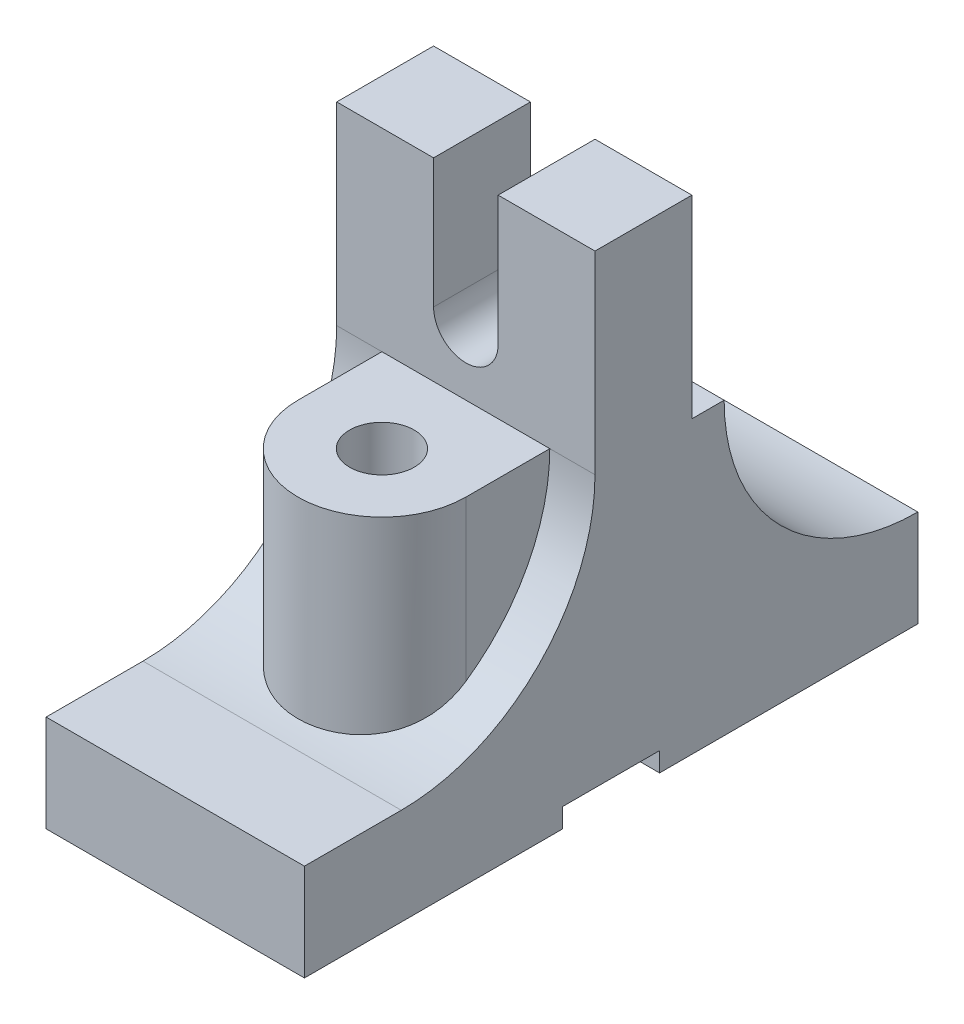
from build123d import *

# Parameters (mm, degrees)
BOSS_EXTRUDE4_DEPTH      = 20
BOSS_EXTRUDE5_REACH      = 70.42
BOSS_EXTRUDE5_END_RADIUS = 30
SKETCH7_R                = 5
CUT_EXTRUDE1_DEPTH       = 69.419660946
SKETCH8_W                = 15
SKETCH8_H                = 30
BOSS_EXTRUDE6_DEPTH      = 40
CUT_EXTRUDE2_REACH       = 94.331


with BuildPart() as part:
    # Sketch1 → Boss-Extrude4 (new, symmetric)
    with BuildSketch(Plane(origin=(0, 0, 0), x_dir=(0, 0, -1), z_dir=(1, 0, 0))):
        with BuildLine():
            Line((-47.5, 0), (-7.5, 0))
            Line((-7.5, 0), (-7.5, 3))
            Line((-7.5, 3), (7.5, 3))
            Line((7.5, 3), (7.5, 0))
            Line((7.5, 0), (47.5, 0))
            Line((47.5, 0), (47.5, 15))
            ThreePointArc((47.5, 15), (26.286796564, 23.786796564), (17.5, 45))
            Line((17.5, 45), (12.5, 45))
            Line((12.5, 45), (-2.5, 45))
            ThreePointArc((-2.5, 45), (-11.286796564, 23.786796564), (-32.5, 15))
            Line((-32.5, 15), (-47.5, 15))
            Line((-47.5, 15), (-47.5, 0))
        make_face()
    extrude(amount=BOSS_EXTRUDE4_DEPTH, both=True)

    # Boss-Extrude5: up to this cylinder (the profile starts inside it)
    boss_extrude5_end = Plane(origin=(0, 45, 32.5), z_dir=(-1, 0, 0)) * Cylinder(BOSS_EXTRUDE5_END_RADIUS, 201.84, mode=Mode.PRIVATE)
    # Sketch6 → Boss-Extrude5 (add, up to the surface)
    with BuildSketch(Plane(origin=(0, 45, 0), x_dir=(1, 0, 0), z_dir=(0, 1, 0)), mode=Mode.PRIVATE) as boss_extrude5_sk1:
        with BuildLine():
            Line((-13, -15.5), (-13, -2.5))
            Line((-13, -2.5), (13, -2.5))
            Line((13, -2.5), (13, -15.5))
            ThreePointArc((13, -15.5), (0, -28.5), (-13, -15.5))
        make_face()
    boss_extrude5_tool1 = extrude(boss_extrude5_sk1.sketch, amount=-BOSS_EXTRUDE5_REACH, mode=Mode.PRIVATE) & boss_extrude5_end
    add(boss_extrude5_tool1.solids().sort_by_distance((0, 45, 14.286452))[0])

    # Sketch7 → Cut-Extrude1 (cut, through all)
    with BuildSketch(Plane(origin=(0, 45, 0), x_dir=(1, 0, 0), z_dir=(0, 1, 0))):
        with Locations(Location((0, -15.5, 0), (0, 0, 270))):
            Circle(SKETCH7_R)
    extrude(amount=-CUT_EXTRUDE1_DEPTH, mode=Mode.SUBTRACT)

    # Sketch8 → Boss-Extrude6 (add)
    with BuildSketch(Plane(origin=(20, 0, 0), x_dir=(0, 0, -1), z_dir=(1, 0, 0))):
        with Locations((5, 60)):
            Rectangle(SKETCH8_W, SKETCH8_H)
    extrude(amount=-BOSS_EXTRUDE6_DEPTH)

    # Sketch9 → Cut-Extrude2 (cut, up to next)
    with BuildSketch(Plane.XY.offset(2.5), mode=Mode.PRIVATE) as cut_extrude2_sk1:
        with BuildLine():
            Line((-5, 75), (5, 75))
            Line((5, 75), (5, 55))
            ThreePointArc((5, 55), (0, 50), (-5, 55))
            Line((-5, 55), (-5, 75))
        make_face()
    cut_extrude2_tool1 = extrude(cut_extrude2_sk1.sketch, amount=-CUT_EXTRUDE2_REACH, mode=Mode.PRIVATE) & part.part
    add(cut_extrude2_tool1.solids().sort_by_distance((0, 63.010479, 2.5))[0], mode=Mode.SUBTRACT)


solid = part.part
